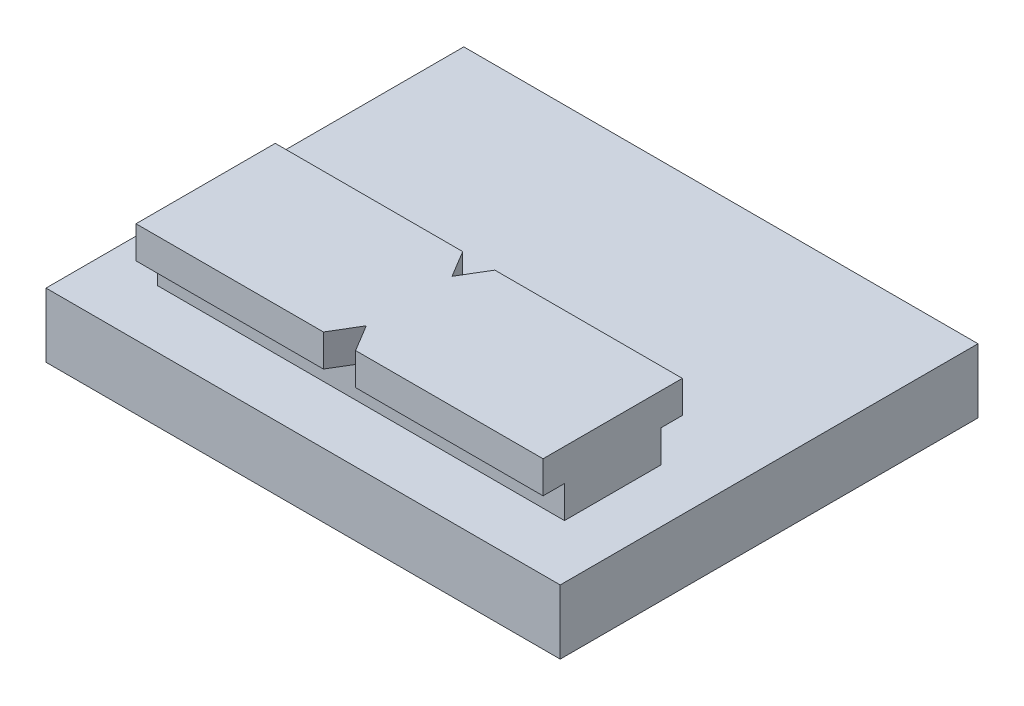
from build123d import *

# Parameters (mm, degrees)
SKETCH1_W           = 24
SKETCH1_H           = 19.5
BOSS_EXTRUDE1_DEPTH = 3
SKETCH3_W           = 19
SKETCH3_H           = 4.5
BOSS_EXTRUDE2_DEPTH = 1.5
SKETCH4_W           = 19
SKETCH4_H           = 6.5
BOSS_EXTRUDE3_DEPTH = 1.5
CUT_EXTRUDE1_DEPTH  = 1.5


with BuildPart() as part:
    # Sketch1 → Boss-Extrude1 (new body)
    with BuildSketch(Plane(origin=(0, 0, 0), x_dir=(1, 0, 0), z_dir=(0, 1, 0))):
        Rectangle(SKETCH1_W, SKETCH1_H)
    extrude(amount=BOSS_EXTRUDE1_DEPTH)

    # Sketch3 → Boss-Extrude2 (add)
    with BuildSketch(Plane(origin=(0, 3, 0), x_dir=(1, 0, 0), z_dir=(0, 1, 0))):
        with Locations((0, -4.8)):
            Rectangle(SKETCH3_W, SKETCH3_H)
    extrude(amount=BOSS_EXTRUDE2_DEPTH)

    # Sketch4 → Boss-Extrude3 (add)
    with BuildSketch(Plane(origin=(0, 4.5, 0), x_dir=(1, 0, 0), z_dir=(0, 1, 0))):
        with Locations((0, -4.8)):
            Rectangle(SKETCH4_W, SKETCH4_H)
    extrude(amount=BOSS_EXTRUDE3_DEPTH)

    # Sketch5 → Cut-Extrude1 (cut)
    with BuildSketch(Plane(origin=(0, 6, 0), x_dir=(1, 0, 0), z_dir=(0, 1, 0))):
        Polygon((0, -2.8), (0.75, -1.55), (-0.75, -1.55), align=None)
        Polygon((0, -6.8), (0.75, -8.05), (-0.75, -8.05), align=None)
    extrude(amount=-CUT_EXTRUDE1_DEPTH, mode=Mode.SUBTRACT)


solid = part.part
